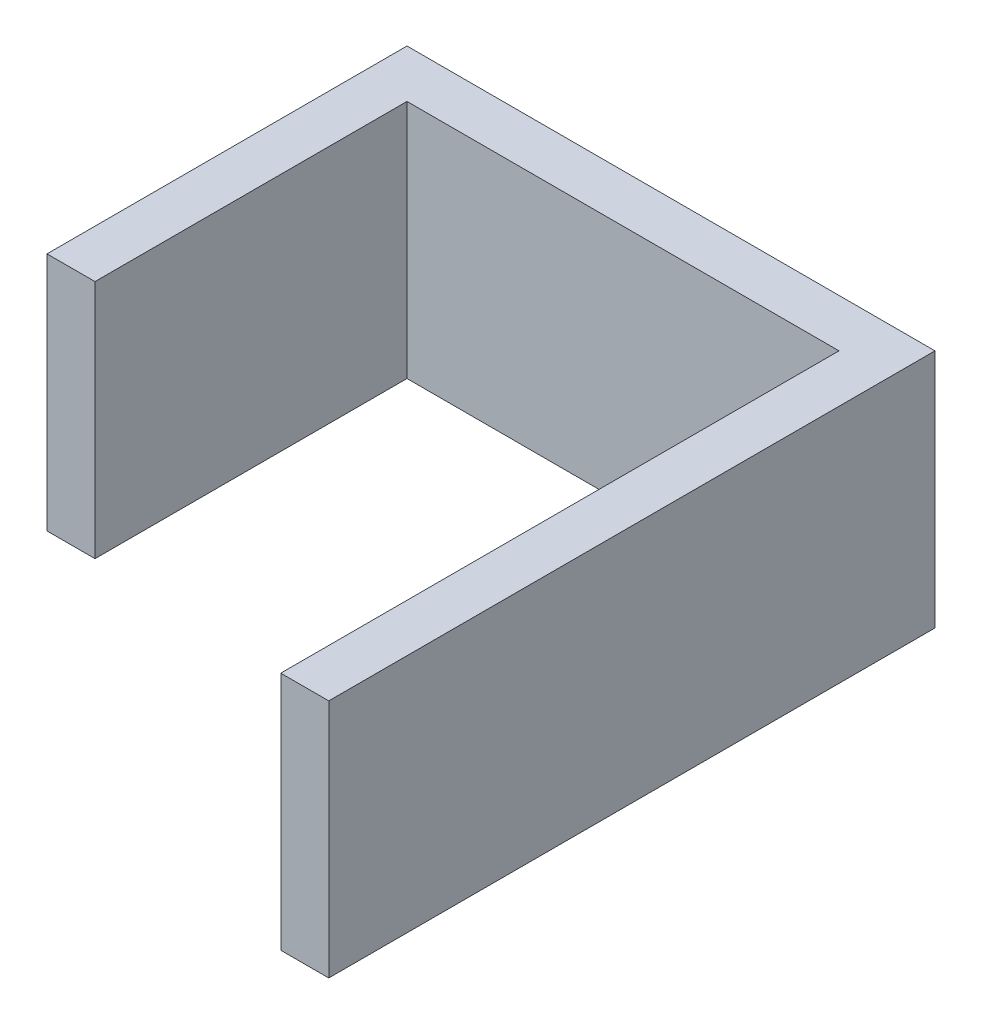
from build123d import *

# Parameters (mm, degrees)
EXTRUDE_1_DEPTH = 10


with BuildPart() as part:
    # 草圖1 → 填料-伸長1 (new body)
    with BuildSketch(Plane(origin=(0, 0, 0), x_dir=(1, 0, 0), z_dir=(0, 1, 0))):
        Polygon((-10, -7.5), (-8, -7.5), (-8, 5.5), (10, 5.5), (10, -17.760223048), (12, -17.760223048), (12, 7.5), (10, 7.5), (-10, 7.5), align=None)
    extrude(amount=EXTRUDE_1_DEPTH)


solid = part.part
